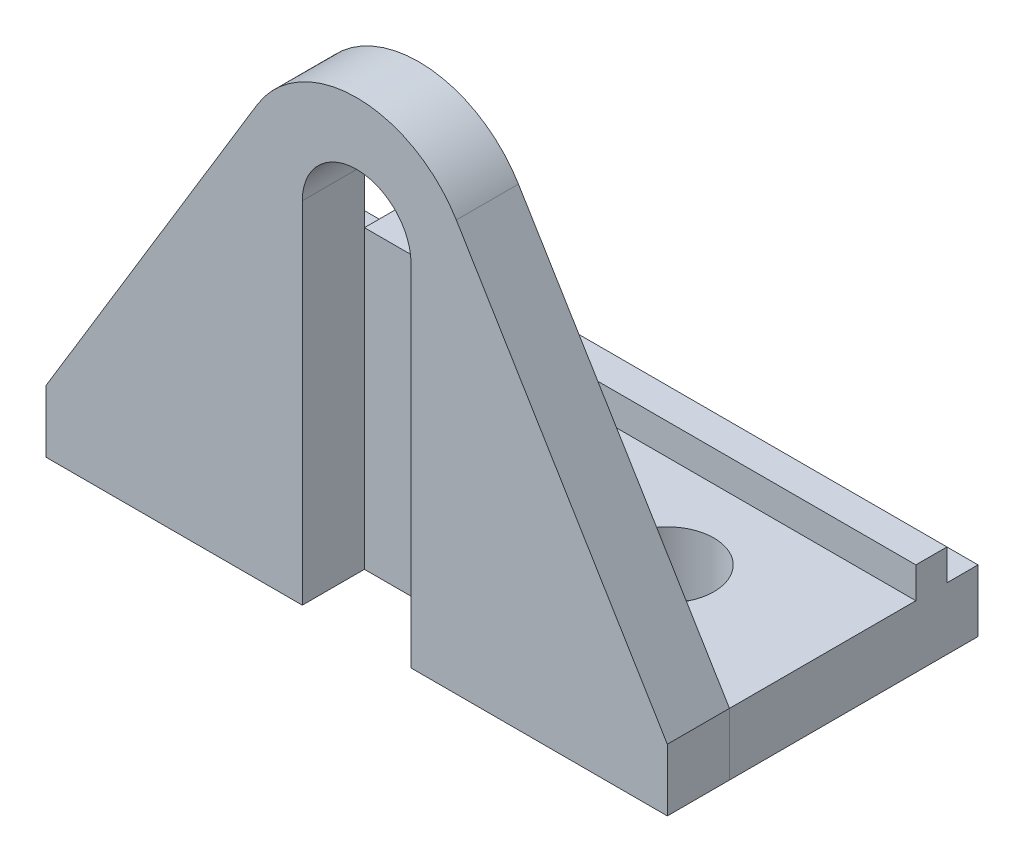
from build123d import *

# Parameters (mm, degrees)
BOSS_EXTRUDE1_DEPTH = 2
BOSS_EXTRUDE4_DEPTH = 2
SKETCH4_W           = 20
SKETCH4_H           = 2
BOSS_EXTRUDE5_DEPTH = 6
SKETCH5_W           = 20
SKETCH5_H           = 1
BOSS_EXTRUDE6_DEPTH = 1
SKETCH6_R           = 1.5
CUT_EXTRUDE2_DEPTH  = 2


with BuildPart() as part:
    # Sketch1 → Boss-Extrude1 (new body)
    with BuildSketch(Plane.XY):
        with BuildLine():
            Line((10.723202921, -1), (10.723202921, 1))
            Line((10.723202921, 1), (3.93099581, 12.217572551))
            ThreePointArc((3.93099581, 12.217572551), (0.723202921, 14.025263413), (-2.484589967, 12.217572551))
            Line((-2.484589967, 12.217572551), (-9.276797079, 1))
            Line((-9.276797079, 1), (-9.276797079, -1))
            Line((-9.276797079, -1), (-1.026797079, -1))
            Line((-1.026797079, -1), (-1.026797079, 10.275263413))
            ThreePointArc((-1.026797079, 10.275263413), (0.723202921, 12.025263413), (2.473202921, 10.275263413))
            Line((2.473202921, 10.275263413), (2.473202921, -1))
            Line((2.473202921, -1), (10.723202921, -1))
        make_face()
    extrude(amount=BOSS_EXTRUDE1_DEPTH)


with BuildPart() as body_2:
    # Sketch2 → Boss-Extrude4 (new body)
    with BuildSketch(Plane(origin=(0, 0, 0), x_dir=(-1, 0, 0), z_dir=(0, 0, -1))):
        Polygon((-10.723202921, -1), (9.276797079, -1), (9.276797079, 1), (1.026797079, 1), (1.026797079, 8.525), (-2.473202921, 8.525), (-2.473202921, 1), (-10.723202921, 1), align=None)
    extrude(amount=BOSS_EXTRUDE4_DEPTH)

    # Sketch4 → Boss-Extrude5 (add)
    with BuildSketch(Plane(origin=(0, 0, -2), x_dir=(-1, 0, 0), z_dir=(0, 0, -1))):
        with Locations((-0.723202921, 0)):
            Rectangle(SKETCH4_W, SKETCH4_H)
    extrude(amount=BOSS_EXTRUDE5_DEPTH)

    # Sketch5 → Boss-Extrude6 (add)
    with BuildSketch(Plane(origin=(0, 1, 0), x_dir=(1, 0, 0), z_dir=(0, 1, 0))):
        with Locations((0.723202921, 6.5)):
            Rectangle(SKETCH5_W, SKETCH5_H)
    extrude(amount=BOSS_EXTRUDE6_DEPTH)

    # Sketch6 → Cut-Extrude2 (cut)
    with BuildSketch(Plane(origin=(0, 1, 0), x_dir=(1, 0, 0), z_dir=(0, 1, 0))):
        with Locations(Location((5.723202921, 3, 0), (0, 0, 270))):
            Circle(SKETCH6_R)
        with Locations(Location((-4.276797079, 3, 0), (0, 0, 270))):
            Circle(SKETCH6_R)
    extrude(amount=-CUT_EXTRUDE2_DEPTH, mode=Mode.SUBTRACT)


solid = Compound([part.part, body_2.part])
